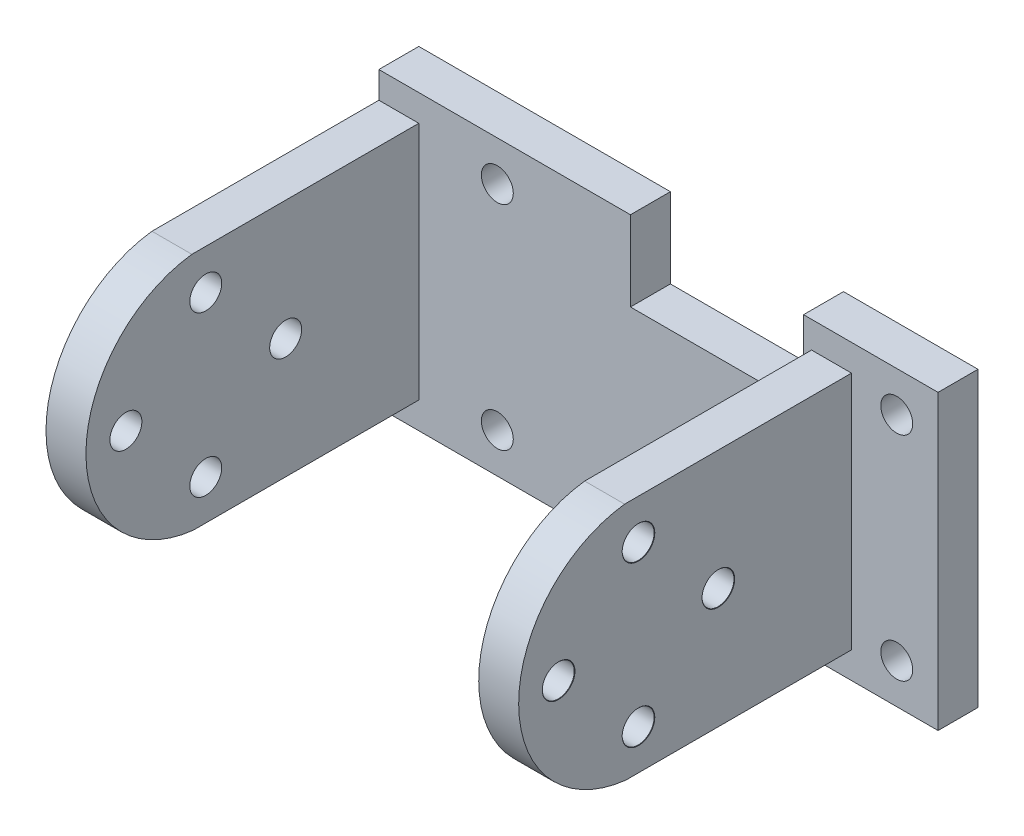
from build123d import *

# Parameters (mm, degrees)
SKETCH1_W                      = 42
SKETCH1_H                      = 22
BOSS_EXTRUDE1_DEPTH            = 3
SKETCH2_W                      = 13
SKETCH2_H                      = 6
CUT_EXTRUDE1_DEPTH             = 233.19450244
SKETCH3_W                      = 13
SKETCH3_H                      = 6
CUT_EXTRUDE2_DEPTH             = 233.19450244
BOSS_EXTRUDE2_DEPTH            = 3
BOSS_EXTRUDE3_START            = -3
BOSS_EXTRUDE3_DEPTH            = 3
M2_CLEARANCE_HOLE1_D           = 2.4
M2_CLEARANCE_HOLE1_CSINK_D     = 2.45
M2_CLEARANCE_HOLE1_CSINK_ANGLE = 90
M2_CLEARANCE_HOLE2_D           = 2.4


with BuildPart() as part:
    # Sketch1 → Boss-Extrude1 (new body)
    with BuildSketch(Plane.XY.offset(163.526991532)):
        with Locations((15.20664665, 218.33461514)):
            Rectangle(SKETCH1_W, SKETCH1_H)
    extrude(amount=-BOSS_EXTRUDE1_DEPTH)

    # Sketch2 → Cut-Extrude1 (cut, through all)
    with BuildSketch(Plane(origin=(0, 0, 160.526991532), x_dir=(-1, 0, 0), z_dir=(0, 0, -1))):
        with Locations((-19.603323325, 226.33461514)):
            Rectangle(SKETCH2_W, SKETCH2_H)
    extrude(amount=-CUT_EXTRUDE1_DEPTH, mode=Mode.SUBTRACT)

    # Sketch3 → Cut-Extrude2 (cut, through all)
    with BuildSketch(Plane(origin=(0, 0, 160.526991532), x_dir=(-1, 0, 0), z_dir=(0, 0, -1))):
        with Locations((-19.603323325, 210.33461514)):
            Rectangle(SKETCH3_W, SKETCH3_H)
    extrude(amount=-CUT_EXTRUDE2_DEPTH, mode=Mode.SUBTRACT)

    # Sketch4 → Boss-Extrude2 (add)
    with BuildSketch(Plane(origin=(-5.79335335, 0, 0), x_dir=(0, -1, 0), z_dir=(-1, 0, 0))):
        with BuildLine():
            Line((-227.33461514, 180.570138914), (-227.33461514, 163.526991532))
            Line((-227.33461514, 163.526991532), (-209.33461514, 163.526991532))
            Line((-209.33461514, 163.526991532), (-209.33461514, 180.47391761))
            ThreePointArc((-209.33461514, 180.47391761), (-218.291824267, 188.52686382), (-227.33461514, 180.570138914))
        make_face()
    extrude(amount=-BOSS_EXTRUDE2_DEPTH)

    # Sketch5 → Boss-Extrude3 (add)
    with BuildSketch(Plane(origin=(29.70664665, 0, 0), x_dir=(0, 0, -1), z_dir=(1, 0, 0)).offset(BOSS_EXTRUDE3_START)):
        with BuildLine():
            Line((-180.47391761, 209.33461514), (-163.526991532, 209.33461514))
            Line((-163.526991532, 209.33461514), (-163.526991532, 227.33461514))
            Line((-163.526991532, 227.33461514), (-180.570138914, 227.33461514))
            ThreePointArc((-180.570138914, 227.33461514), (-188.52686382, 218.291824267), (-180.47391761, 209.33461514))
        make_face()
    extrude(amount=BOSS_EXTRUDE3_DEPTH)

    # M2 Clearance Hole1 (through all)
    with Locations(Plane(origin=(29.70664665, 0, 0), x_dir=(0, 0, -1), z_dir=(1, 0, 0))):
        with Locations((-179.527190494, 224.334217217), (-185.526991532, 218.334416179), (-179.527190494, 212.33461514), (-173.527389456, 218.334416179)):
            CounterSinkHole(M2_CLEARANCE_HOLE1_D / 2, M2_CLEARANCE_HOLE1_CSINK_D / 2, counter_sink_angle=M2_CLEARANCE_HOLE1_CSINK_ANGLE)

    # M2 Clearance Hole2 (through all)
    with Locations(Plane.XY.offset(163.526991532)):
        with Locations((3.103323325, 226.326974637), (3.103323325, 210.326974637), (33.103323325, 210.326974637), (33.103323325, 226.326974637)):
            Hole(M2_CLEARANCE_HOLE2_D / 2)


solid = part.part
